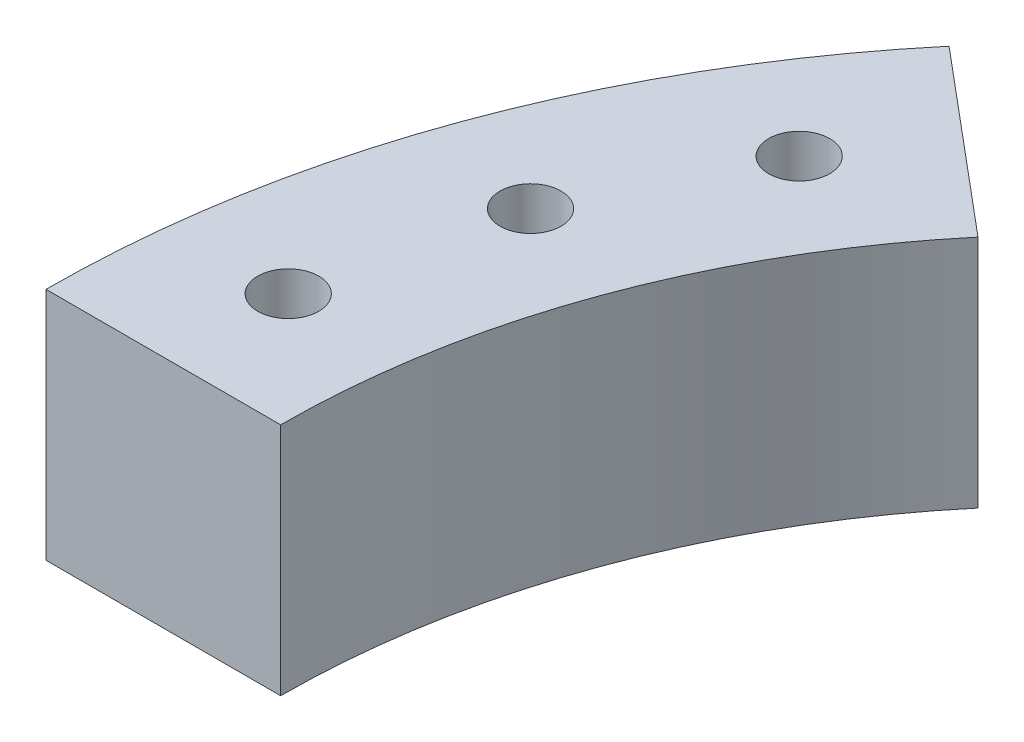
from build123d import *

# Parameters (mm, degrees)
SKETCH1_R           = 2.6
BOSS_EXTRUDE1_DEPTH = 20


with BuildPart() as part:
    # Sketch1 → Boss-Extrude1 (new body)
    with BuildSketch(Plane(origin=(0, 0, 0), x_dir=(1, 0, 0), z_dir=(0, 1, 0))):
        with BuildLine():
            Line((10, 0), (-10, 0))
            ThreePointArc((-10, 0), (-4.705844869, 30.024645745), (10.538067282, 56.427876097))
            Line((10.538067282, 56.427876097), (25.858956145, 43.572123903))
            ThreePointArc((25.858956145, 43.572123903), (14.088007547, 23.184242879), (10, 0))
        make_face()
        with Locations(Location((0.645465629, 10, 0), (0, 0, 270))):
            Circle(SKETCH1_R, mode=Mode.SUBTRACT)
        with Locations(Location((4.691081339, 26.604444312, 0), (0, 0, 270))):
            Circle(SKETCH1_R, mode=Mode.SUBTRACT)
        with Locations(Location((12.265090975, 41.92465826, 0), (0, 0, 270))):
            Circle(SKETCH1_R, mode=Mode.SUBTRACT)
    extrude(amount=BOSS_EXTRUDE1_DEPTH)


solid = part.part
